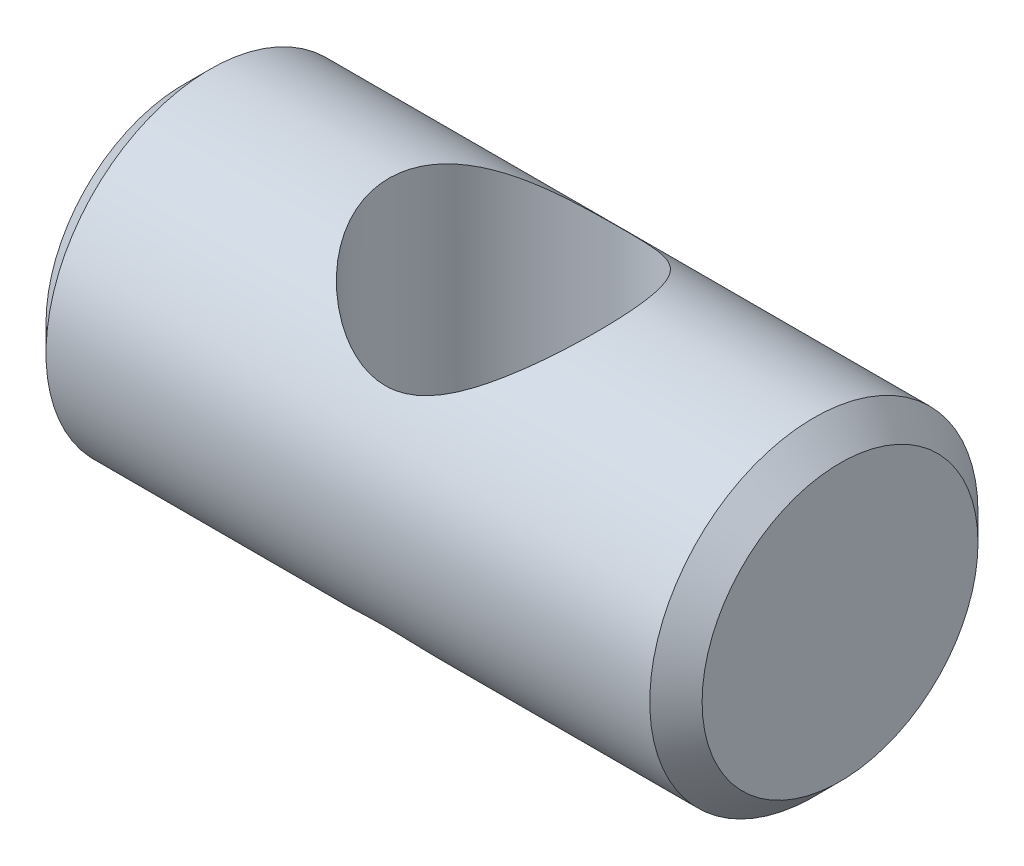
from build123d import *

# Parameters (mm, degrees)
SKETCH1_R           = 4.765
BOSS_EXTRUDE1_DEPTH = 9.525
CHAMFER1_SIZE       = 0.76
SKETCH2_R           = 3.43
CUT_EXTRUDE1_DEPTH  = 9.525


with BuildPart() as part:
    # Sketch1 → Boss-Extrude1 (new, symmetric)
    with BuildSketch(Plane(origin=(0, 0, 0), x_dir=(0, 0, -1), z_dir=(1, 0, 0))):
        with Locations(Location((0, 0, 0), (0, 0, 180))):
            Circle(SKETCH1_R)
    extrude(amount=BOSS_EXTRUDE1_DEPTH, both=True)

    # Chamfer1
    chamfer1_edges = [part.edges().sort_by_distance(p)[0] for p in [
        (-9.525, 0, -4.765),
        (9.525, 0, -4.765),
    ]]
    chamfer(chamfer1_edges, length=CHAMFER1_SIZE)

    # Sketch2 → Cut-Extrude1 (cut, symmetric)
    with BuildSketch(Plane(origin=(0, 0, 0), x_dir=(1, 0, 0), z_dir=(0, 1, 0))):
        with Locations(Location((0, -0.25, 0), (0, 0, 270))):
            Circle(SKETCH2_R)
    extrude(amount=CUT_EXTRUDE1_DEPTH, both=True, mode=Mode.SUBTRACT)


solid = part.part
